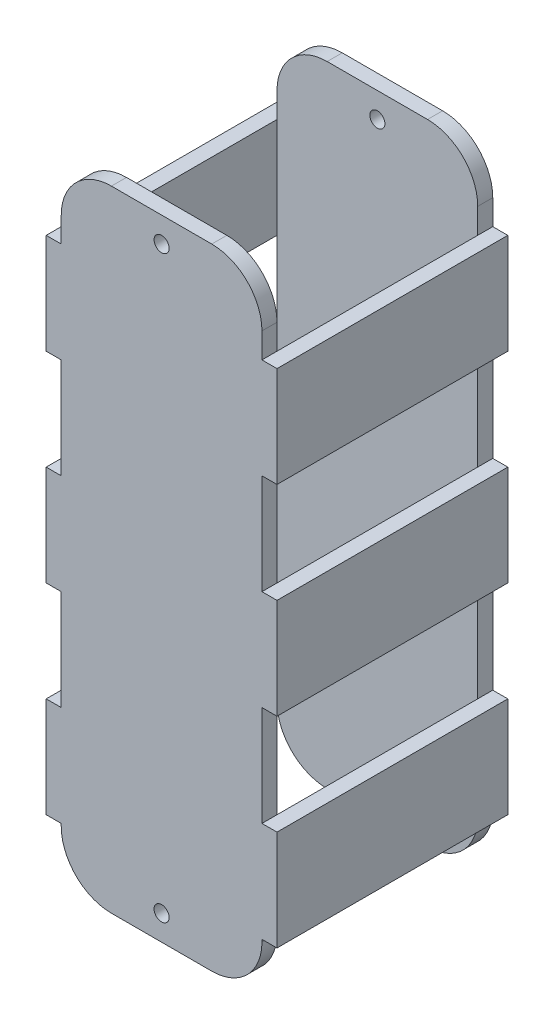
from build123d import *

# Parameters (mm, degrees)
BOSS_EXTRUDE1_START     = 40
BOSS_EXTRUDE1_DEPTH     = 3
BOSS_EXTRUDE2_DEPTH     = 3
CUT_EXTRUDE1_DEPTH      = 79.654704246
CUT_EXTRUDE1_DEPTH_BACK = 79.654704246
SKETCH2_R               = 1.5
SKETCH3_W               = 46
SKETCH3_H               = 20
BOSS_EXTRUDE4_DEPTH     = 3


with BuildPart() as part:
    # Sketch1 → Boss-Extrude1 (new body)
    with BuildSketch(Plane.XY.offset(BOSS_EXTRUDE1_START)):
        with BuildLine():
            Line((-10, 62.75), (10, 62.75))
            ThreePointArc((10, 62.75), (17.071067812, 59.821067812), (20, 52.75))
            Line((20, 52.75), (20, -52.75))
            ThreePointArc((20, -52.75), (17.071067812, -59.821067812), (10, -62.75))
            Line((10, -62.75), (-10, -62.75))
            ThreePointArc((-10, -62.75), (-17.071067812, -59.821067812), (-20, -52.75))
            Line((-20, -52.75), (-20, 52.75))
            ThreePointArc((-20, 52.75), (-17.071067812, 59.821067812), (-10, 62.75))
        make_face()
    extrude(amount=BOSS_EXTRUDE1_DEPTH)


with BuildPart() as body_2:
    # Sketch1<3> → Boss-Extrude2 (new body)
    with BuildSketch(Plane.XY):
        with BuildLine():
            Line((-10, 62.75), (10, 62.75))
            ThreePointArc((10, 62.75), (17.071067812, 59.821067812), (20, 52.75))
            Line((20, 52.75), (20, -52.75))
            ThreePointArc((20, -52.75), (17.071067812, -59.821067812), (10, -62.75))
            Line((10, -62.75), (-10, -62.75))
            ThreePointArc((-10, -62.75), (-17.071067812, -59.821067812), (-20, -52.75))
            Line((-20, -52.75), (-20, 52.75))
            ThreePointArc((-20, 52.75), (-17.071067812, 59.821067812), (-10, 62.75))
        make_face()
    extrude(amount=-BOSS_EXTRUDE2_DEPTH)


with BuildPart() as cut_extrude1_tool:
    # Sketch2 → Cut-Extrude1 (new, two sides: drawn at the far end of the back side and taken through both)
    with BuildSketch(Plane.XY.offset(-CUT_EXTRUDE1_DEPTH_BACK)):
        with Locations((0, 57.75)):
            Circle(SKETCH2_R)
        with Locations((0, -57.75)):
            Circle(SKETCH2_R)
    extrude(amount=CUT_EXTRUDE1_DEPTH + CUT_EXTRUDE1_DEPTH_BACK)


with BuildPart() as part_1:
    add(part.part)

    # Cut-Extrude1: cut by cut_extrude1_tool
    add(cut_extrude1_tool.part, mode=Mode.SUBTRACT)



with BuildPart() as body_2_1:
    add(body_2.part)

    # Cut-Extrude1: cut by cut_extrude1_tool
    add(cut_extrude1_tool.part, mode=Mode.SUBTRACT)


with BuildPart() as part_2:
    add(part_1.part)

    add(body_2_1.part)  # Boss-Extrude4 merges body 2
    # Sketch3 → Boss-Extrude4 (add)
    with BuildSketch(Plane.ZY.offset(20)):
        with Locations((20, 37.75)):
            Rectangle(SKETCH3_W, SKETCH3_H)
        with Locations((20, -2.25)):
            Rectangle(SKETCH3_W, SKETCH3_H)
        with Locations((20, -42.25)):
            Rectangle(SKETCH3_W, SKETCH3_H)
    boss_extrude4 = extrude(amount=BOSS_EXTRUDE4_DEPTH)

    # Mirror1: Boss-Extrude4 across plane
    add(boss_extrude4.mirror(Plane(origin=(0, 0, 0), x_dir=(0, 0, 1), z_dir=(1, 0, 0))))


solid = part_2.part
